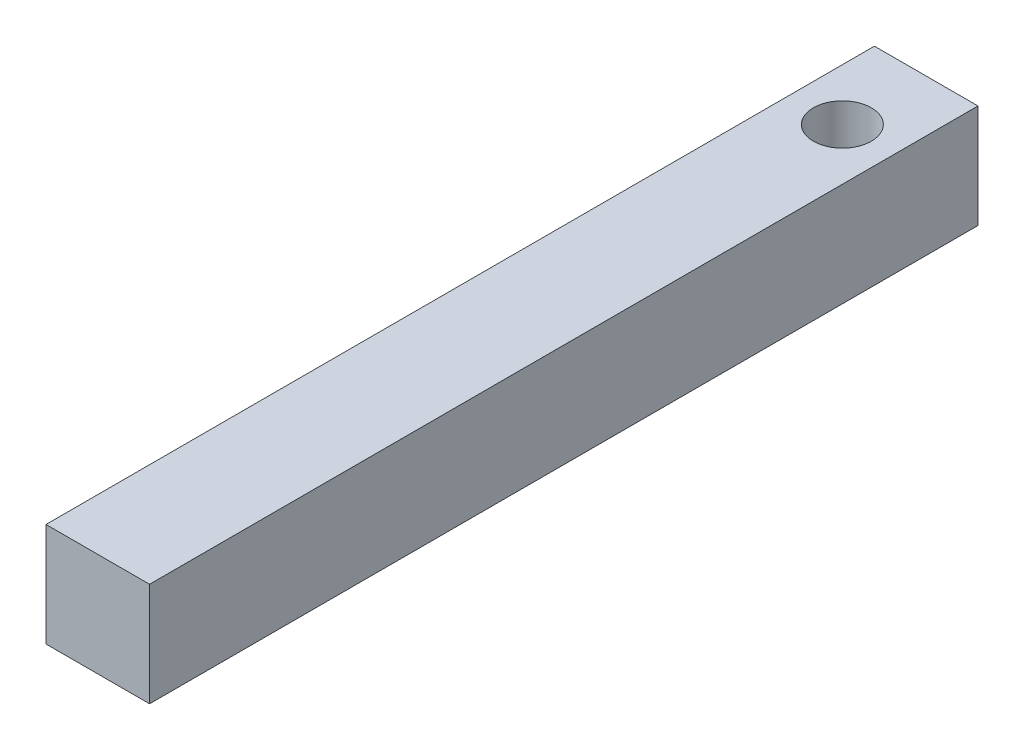
from build123d import *

# Parameters (mm, degrees)
SKETCH_2_W          = 25.4
SKETCH_2_H          = 25.4
EXTRUDE_1_DEPTH     = 203.2
SKETCH_3_R          = 7.112
CUT_EXTRUDE_1_DEPTH = 207.350575478


with BuildPart() as part:
    # 草图2 → 凸台-拉伸1 (new body)
    with BuildSketch(Plane.XY):
        with Locations((12.7, 12.7)):
            Rectangle(SKETCH_2_W, SKETCH_2_H)
    extrude(amount=EXTRUDE_1_DEPTH)

    # 草图3 → 切除-拉伸1 (cut, through all)
    with BuildSketch(Plane(origin=(0, 25.4, 0), x_dir=(1, 0, 0), z_dir=(0, 1, 0))):
        with Locations(Location((12.7, -20.574, 0), (0, 0, 270))):
            Circle(SKETCH_3_R)
    extrude(amount=-CUT_EXTRUDE_1_DEPTH, mode=Mode.SUBTRACT)


solid = part.part
